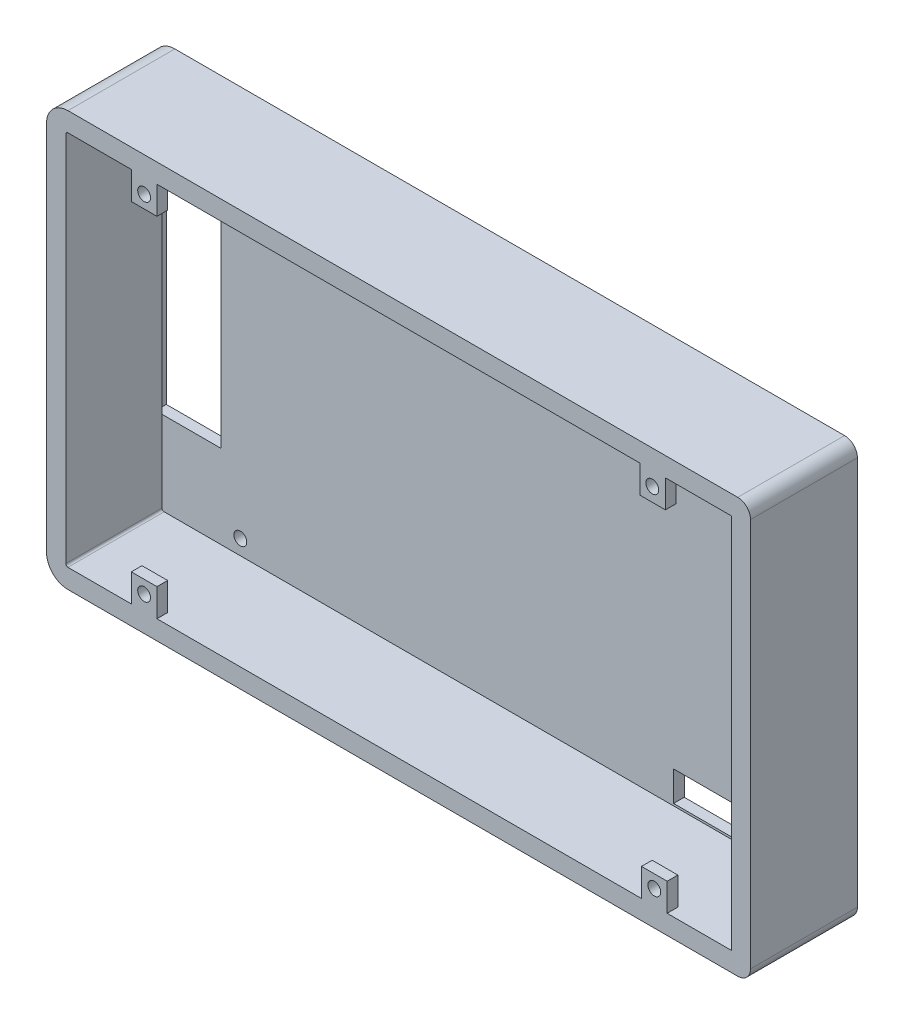
from build123d import *

# Parameters (mm, degrees)
CROQUIS1_W              = 15
CROQUIS1_H              = 7
CROQUIS1_W_2            = 21.106040847
CROQUIS1_H_2            = 4.330702007
CROQUIS1_R              = 1.5
CROQUIS1_W_3            = 15.314275766
CROQUIS1_H_3            = 48.999512223
SALIENTE_EXTRUIR1_DEPTH = 2.5
SALIENTE_EXTRUIR2_DEPTH = 25.5
SALIENTE_EXTRUIR3_REACH = 135.996
CROQUIS3_W              = 155.129666141
CROQUIS3_H              = 2
REDONDEO1_R             = 3
REDONDEO2_R             = 3
CROQUIS6_W              = 172.033889696
CROQUIS6_H              = 4.948845102
CORTAR_EXTRUIR3_DEPTH   = 114.5
SALIENTE_EXTRUIR4_START = -2.5
CROQUIS7_W              = 6
CROQUIS7_H              = 6.5
CROQUIS7_R              = 1.5
SALIENTE_EXTRUIR4_DEPTH = 2.5


with BuildPart() as part:
    # Croquis1 → Saliente-Extruir1 (new body)
    with BuildSketch(Plane.XY):
        with BuildLine():
            Line((92.815390375, 97), (-66.814275766, 97))
            ThreePointArc((-66.814275766, 97), (-70.349809672, 95.535533906), (-71.814275766, 92))
            Line((-71.814275766, 92), (-71.814275766, 5))
            ThreePointArc((-71.814275766, 5), (-70.349809672, 1.464466094), (-66.814275766, 0))
            Line((-66.814275766, 0), (92.815390375, 0))
            Line((92.815390375, 0), (92.815390375, 97))
        make_face()
        with Locations((59.815390375, 8.5)):
            Rectangle(CROQUIS1_W, CROQUIS1_H, mode=Mode.SUBTRACT)
        with Locations((16.385259295, 89.834648996)):
            Rectangle(CROQUIS1_W_2, CROQUIS1_H_2, mode=Mode.SUBTRACT)
        with Locations((59.404912693, 88.5)):
            Rectangle(CROQUIS1_W, CROQUIS1_H, mode=Mode.SUBTRACT)
        with Locations((-49, 8)):
            Circle(CROQUIS1_R, mode=Mode.SUBTRACT)
        with Locations((-61.157137883, 48.499756112)):
            Rectangle(CROQUIS1_W_3, CROQUIS1_H_3, mode=Mode.SUBTRACT)
        with Locations((70.315390375, 8)):
            Circle(CROQUIS1_R, mode=Mode.SUBTRACT)
        with Locations((-49, 89)):
            Circle(CROQUIS1_R, mode=Mode.SUBTRACT)
        with Locations((69.850202166, 89.208902584)):
            Circle(CROQUIS1_R, mode=Mode.SUBTRACT)
    extrude(amount=SALIENTE_EXTRUIR1_DEPTH)

    # Croquis2 → Saliente-Extruir2 (add)
    with BuildSketch(Plane.XY.offset(2.5)):
        with BuildLine():
            Line((-71.814275766, 92), (-71.814275766, 5))
            ThreePointArc((-71.814275766, 5), (-70.349809672, 1.464466094), (-66.814275766, 0))
            Line((-66.814275766, 0), (92.815390375, 0))
            Line((92.815390375, 0), (92.815390375, 97))
            Line((92.815390375, 97), (-66.814275766, 97))
            ThreePointArc((-66.814275766, 97), (-70.349809672, 95.535533906), (-71.814275766, 92))
        make_face()
        with BuildLine():
            Line((-67.314275766, 92), (-67.314275766, 5))
            ThreePointArc((-67.314275766, 5), (-67.167829157, 4.646446609), (-66.814275766, 4.5))
            Line((-66.814275766, 4.5), (88.315390375, 4.5))
            Line((88.315390375, 4.5), (88.315390375, 92.5))
            Line((88.315390375, 92.5), (-66.814275766, 92.5))
            ThreePointArc((-66.814275766, 92.5), (-67.167829157, 92.353553391), (-67.314275766, 92))
        make_face(mode=Mode.SUBTRACT)
    extrude(amount=SALIENTE_EXTRUIR2_DEPTH)

    # Croquis3 → Saliente-Extruir3 (add, up to next)
    with BuildSketch(Plane(origin=(0, 4.5, 0), x_dir=(1, 0, 0), z_dir=(0, 1, 0)), mode=Mode.PRIVATE) as saliente_extruir3_sk1:
        with Locations((10.750557304, -27)):
            Rectangle(CROQUIS3_W, CROQUIS3_H)
    saliente_extruir3_tool1 = extrude(saliente_extruir3_sk1.sketch, amount=SALIENTE_EXTRUIR3_REACH, mode=Mode.PRIVATE) - part.part
    add(saliente_extruir3_tool1.solids().sort_by_distance((10.750557, 4.5, 27))[0])

    # Redondeo1
    redondeo1_edges = [part.edges().sort_by_distance(p)[0] for p in [
        (92.815390375, 97, 14),
        (92.815390375, 0, 14),
    ]]
    fillet(redondeo1_edges, radius=REDONDEO1_R)

    # Redondeo2
    redondeo2_edges = [part.edges().sort_by_distance(p)[0] for p in [
        (92.815390375, 48.5, 28),
        (11.500557304, 97, 28),
        (91.936710719, 96.121320344, 28),
        (91.936710719, 0.878679656, 28),
        (-70.349809672, 95.535533906, 28),
        (-71.814275766, 48.5, 28),
        (-70.349809672, 1.464466094, 28),
        (11.500557304, 0, 28),
    ]]
    fillet(redondeo2_edges, radius=REDONDEO2_R)

    # Croquis6 → Cortar-Extruir3 (cut)
    with BuildSketch(Plane(origin=(0, 0, 0), x_dir=(-1, 0, 0), z_dir=(0, -1, 0))):
        with Locations((-6.798445527, -27.474422551)):
            Rectangle(CROQUIS6_W, CROQUIS6_H)
    extrude(amount=-CORTAR_EXTRUIR3_DEPTH, mode=Mode.SUBTRACT)

    # Croquis7 → Saliente-Extruir4 (add)
    # profile 1 of 4: a face of its own
    with BuildSketch(Plane.XY.offset(25).offset(SALIENTE_EXTRUIR4_START)):
        with Locations((69.908799209, 89.25)):
            Rectangle(CROQUIS7_W, CROQUIS7_H)
        with Locations((69.850202166, 89.208902584)):
            Circle(CROQUIS7_R, mode=Mode.SUBTRACT)
    # profile 2 of 4: a face of its own
    with BuildSketch(Plane.XY.offset(25).offset(SALIENTE_EXTRUIR4_START)):
        with Locations((-49, 89.25)):
            Rectangle(CROQUIS7_W, CROQUIS7_H)
        with Locations((-49, 89)):
            Circle(CROQUIS7_R, mode=Mode.SUBTRACT)
    # profile 3 of 4: a face of its own
    with BuildSketch(Plane.XY.offset(25).offset(SALIENTE_EXTRUIR4_START)):
        with Locations((70.315390375, 7.75)):
            Rectangle(CROQUIS7_W, CROQUIS7_H)
        with Locations((70.315390375, 8)):
            Circle(CROQUIS7_R, mode=Mode.SUBTRACT)
    # profile 4 of 4: a face of its own
    with BuildSketch(Plane.XY.offset(25).offset(SALIENTE_EXTRUIR4_START)):
        with Locations((-49, 7.75)):
            Rectangle(CROQUIS7_W, CROQUIS7_H)
        with Locations((-49, 8)):
            Circle(CROQUIS7_R, mode=Mode.SUBTRACT)
    extrude(amount=SALIENTE_EXTRUIR4_DEPTH)


solid = part.part
